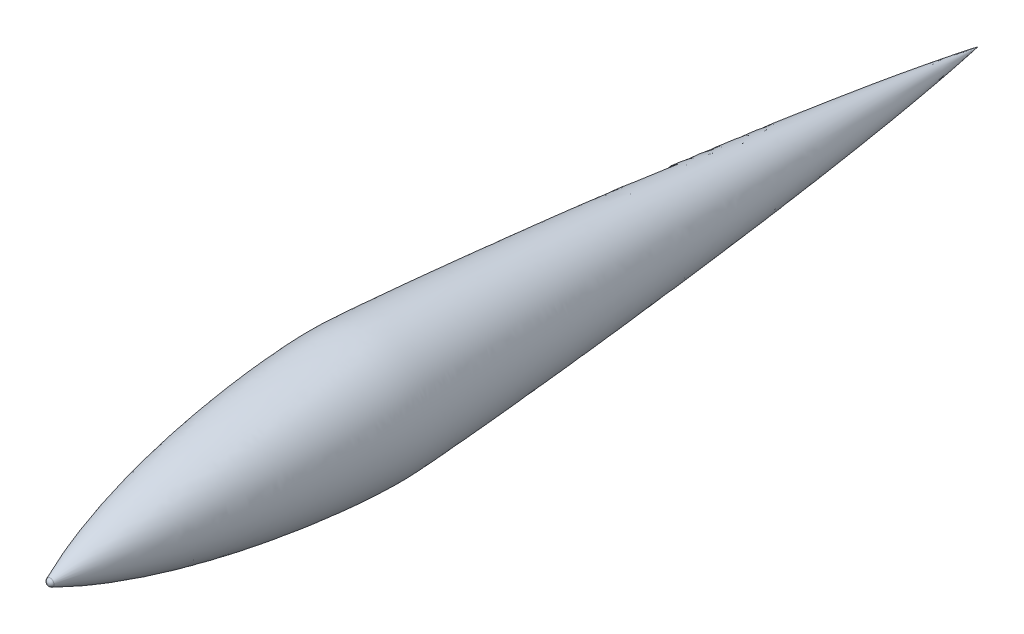
from build123d import *


with BuildPart() as part:
    # Sketch1 → Revolve1 (revolve)
    with BuildSketch(Plane(origin=(0, 0, 0), x_dir=(0, 0, -1), z_dir=(1, 0, 0))):
        with BuildLine():
            ThreePointArc((-72.973703772, 0.91590963), (-73.409392866, 0.547090239), (-73.57231923, 0))
            Line((-73.57231923, 0), (150, 0))
            add(Edge.make_bspline(
                [(-72.973703772, 0.91590963), (-50.012288552, 10.978427624), (-8.450378222, 15.425380275), (20.01910705, 14.34667125), (111.592497633, 6.772278929), (150, 0)],
                knots=[0.009067151, 0.009067151, 0.009067151, 0.009067151, 0.313878319, 0.413878319, 1, 1, 1, 1], degree=3))
        make_face()
    revolve(axis=Axis((0, 0, 0), (0, 0, -1)))


solid = part.part
